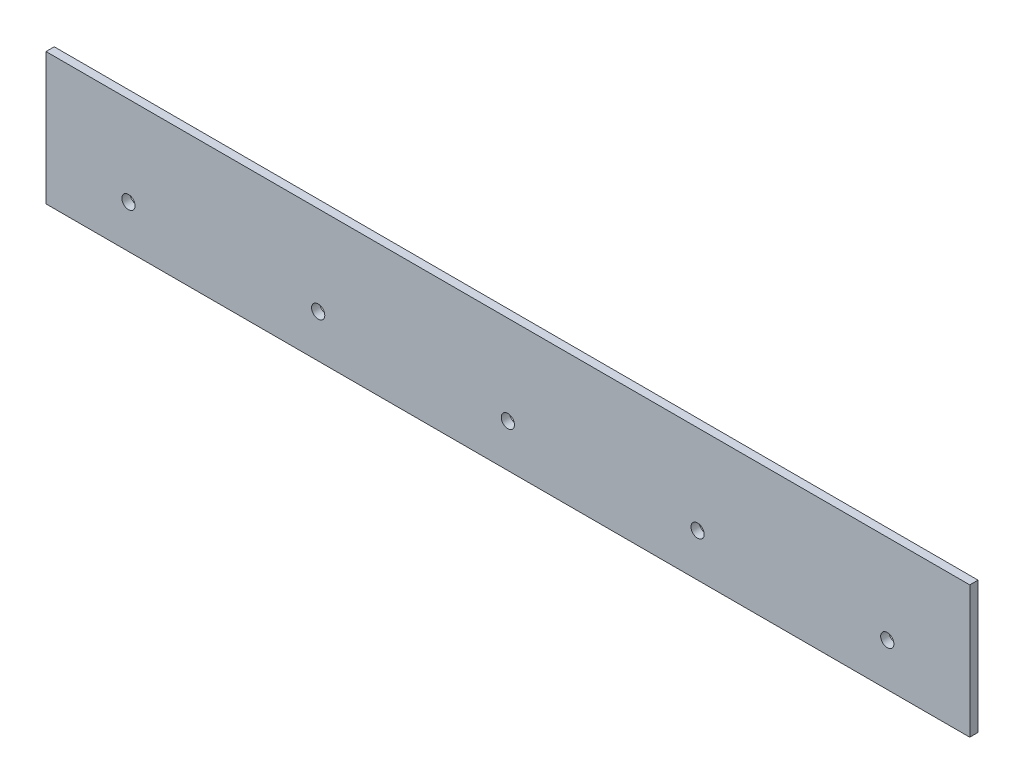
from build123d import *

# Parameters (mm, degrees)
SKETCH1_W           = 355.6
SKETCH1_H           = 50.8
SKETCH1_R           = 2.54
BOSS_EXTRUDE1_DEPTH = 3.175


with BuildPart() as part:
    # Sketch1 → Boss-Extrude1 (new body)
    with BuildSketch(Plane.XY):
        Rectangle(SKETCH1_W, SKETCH1_H)
        with Locations((0, -8.89)):
            Circle(SKETCH1_R, mode=Mode.SUBTRACT)
        with Locations((-146.05, -8.89)):
            Circle(SKETCH1_R, mode=Mode.SUBTRACT)
        with Locations((-73.025, -8.89)):
            Circle(SKETCH1_R, mode=Mode.SUBTRACT)
        with Locations(Location((73.025, -8.89, 0), (0, 0, 180))):
            Circle(SKETCH1_R, mode=Mode.SUBTRACT)
        with Locations(Location((146.05, -8.89, 0), (0, 0, 180))):
            Circle(SKETCH1_R, mode=Mode.SUBTRACT)
    extrude(amount=BOSS_EXTRUDE1_DEPTH)


solid = part.part
